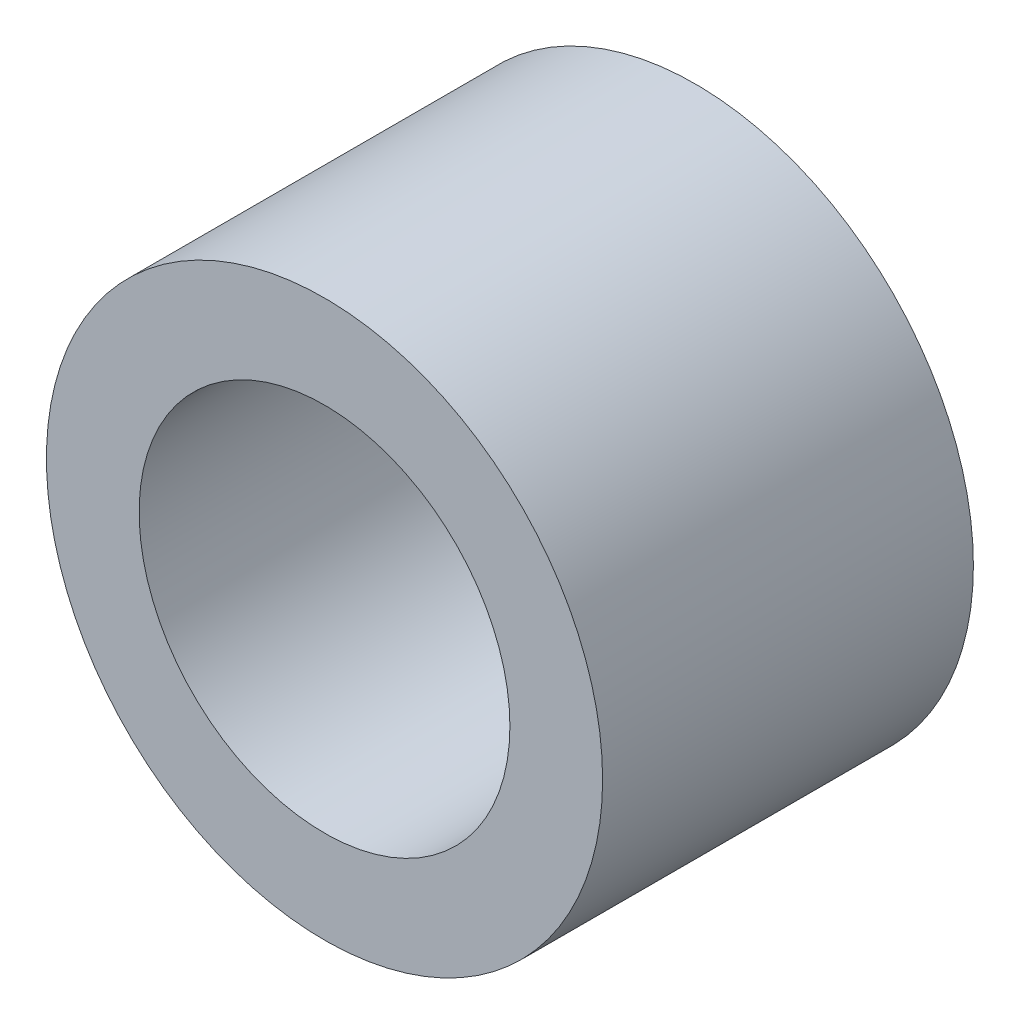
from build123d import *

# Parameters (mm, degrees)
SKETCH1_R                      = 9
SKETCH1_R_2                    = 6
EX_BEARING_ENVELOPE_12MM_DEPTH = 6


with BuildPart() as part:
    # Sketch1 → EX_Bearing_Envelope_12mm (new, symmetric)
    with BuildSketch(Plane.XY):
        Circle(SKETCH1_R)
        Circle(SKETCH1_R_2, mode=Mode.SUBTRACT)
    extrude(amount=EX_BEARING_ENVELOPE_12MM_DEPTH, both=True)


solid = part.part
